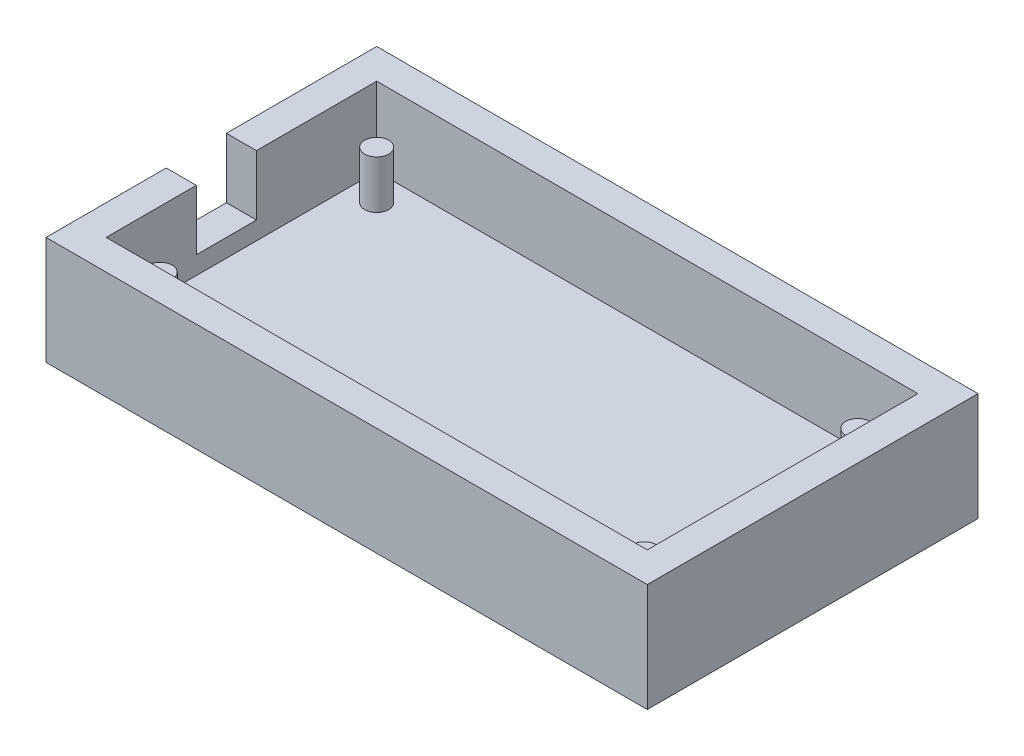
from build123d import *

# Parameters (mm, degrees)
SKETCH1_W           = 99.999999898
SKETCH1_H           = 54.999999982
BOSS_EXTRUDE4_DEPTH = 5
BOSS_EXTRUDE6_DEPTH = 13
SKETCH2_3_W         = 5
SKETCH2_3_H         = 10
BOSS_EXTRUDE7_DEPTH = 3
SKETCH4_R           = 2
BOSS_EXTRUDE8_DEPTH = 8


with BuildPart() as part:
    # Sketch1 → Boss-Extrude4 (new body)
    with BuildSketch(Plane(origin=(0, 0, 0), x_dir=(1, 0, 0), z_dir=(0, 1, 0))):
        with Locations((31.542022725, 14.806957854)):
            Rectangle(SKETCH1_W, SKETCH1_H)
    extrude(amount=-BOSS_EXTRUDE4_DEPTH)

    # Sketch2 → Boss-Extrude6 (add)
    with BuildSketch(Plane(origin=(0, 0, 0), x_dir=(1, 0, 0), z_dir=(0, 1, 0))):
        Polygon((81.542022674, 42.306957845), (-18.457977224, 42.306957845), (-18.457977224, 17.306957845), (-13.457977224, 17.306957845), (-13.457977224, 37.306957845), (76.542022776, 37.306957845), (76.542022776, -7.693042155), (-13.457977224, -7.693042155), (-13.457977224, 7.306957845), (-18.457977224, 7.306957845), (-18.457977224, -12.693042137), (81.542022674, -12.693042137), align=None)
    extrude(amount=BOSS_EXTRUDE6_DEPTH)

    # Sketch2<3> → Boss-Extrude7 (add)
    with BuildSketch(Plane(origin=(0, 0, 0), x_dir=(1, 0, 0), z_dir=(0, 1, 0))):
        with Locations((-15.957977224, 12.306957845)):
            Rectangle(SKETCH2_3_W, SKETCH2_3_H)
    extrude(amount=BOSS_EXTRUDE7_DEPTH)

    # Sketch4 → Boss-Extrude8 (add)
    with BuildSketch(Plane(origin=(0, 0, 0), x_dir=(1, 0, 0), z_dir=(0, 1, 0))):
        with Locations((-8.957977224, 32.806957845)):
            Circle(SKETCH4_R)
        with Locations((-8.957977224, -3.193042155)):
            Circle(SKETCH4_R)
        with Locations((71.542022776, -3.193042155)):
            Circle(SKETCH4_R)
        with Locations((71.542022776, 32.306957845)):
            Circle(SKETCH4_R)
    extrude(amount=BOSS_EXTRUDE8_DEPTH)


solid = part.part
